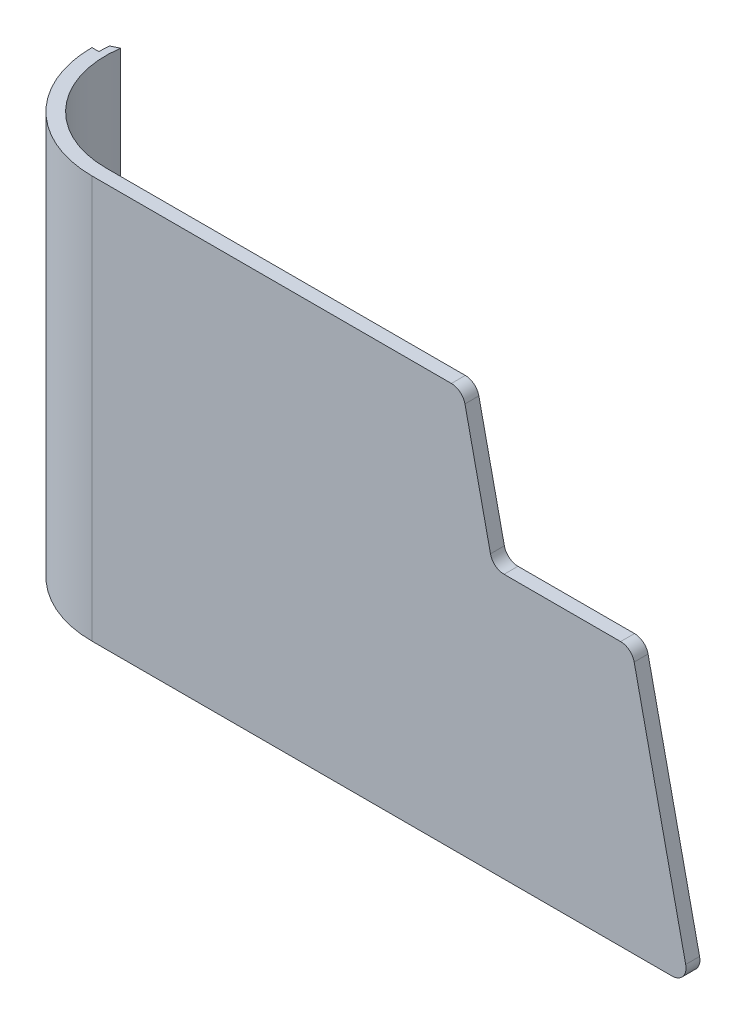
from build123d import *

# Parameters (mm, degrees)
BOSS_EXTRUDE1_DEPTH = 58
CUT_EXTRUDE1_DEPTH  = 90.688349299
FILLET1_R           = 2


with BuildPart() as part:
    # Sketch1 → Boss-Extrude1 (new body)
    with BuildSketch(Plane(origin=(0, 0, 0), x_dir=(1, 0, 0), z_dir=(0, 1, 0))):
        with BuildLine():
            Line((-50, -14), (36, -14))
            Line((36, -14), (36, -16))
            Line((36, -16), (-50, -16))
            ThreePointArc((-50, -16), (-61.313708499, -11.313708499), (-66, 0))
            Line((-66, 0), (-65, 0))
            ThreePointArc((-65, 0), (-64.982153791, 0.731483276), (-64.928657629, 1.461225992))
            Line((-64.928657629, 1.461225992), (-63.856406461, 2))
            ThreePointArc((-63.856406461, 2), (-60.583005244, -9.16515139), (-50, -14))
        make_face()
    extrude(amount=BOSS_EXTRUDE1_DEPTH)

    # Sketch2 → Cut-Extrude1 (cut, through all)
    with BuildSketch(Plane.XY.offset(16)):
        Polygon((36, 0), (27.714660104, 38), (7.714660104, 38), (3.353954895, 58), (36, 58), align=None)
    extrude(amount=-CUT_EXTRUDE1_DEPTH, mode=Mode.SUBTRACT)

    # Fillet1
    fillet1_edges = [part.edges().sort_by_distance(p)[0] for p in [
        (3.353954895, 58, 15),
        (27.714660104, 38, 15),
        (7.714660104, 38, 15),
        (36, 0, 15),
    ]]
    fillet(fillet1_edges, radius=FILLET1_R)


solid = part.part
